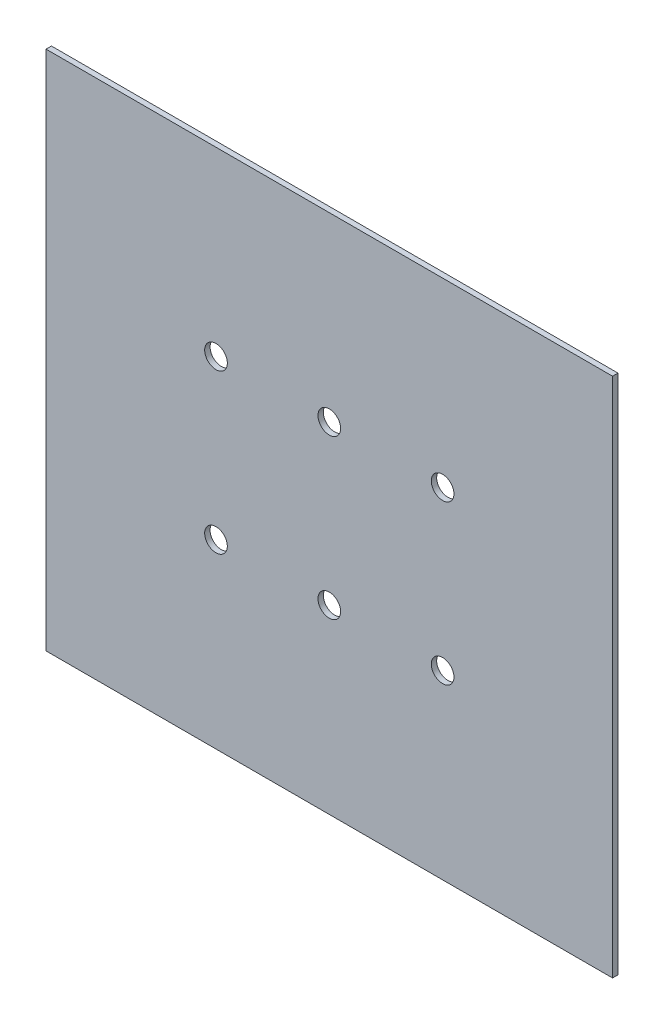
from build123d import *

# Parameters (mm, degrees)
ESBO_O1_W                = 500
ESBO_O1_H                = 460
ESBO_O1_R                = 10
RESSALTO_EXTRUS_O1_DEPTH = 4.7625


with BuildPart() as part:
    # Esboço1 → Ressalto-extrusão1 (new body)
    with BuildSketch(Plane.XY):
        with Locations((-100, 70)):
            Rectangle(ESBO_O1_W, ESBO_O1_H)
        with Locations(Location((0, 0, 0), (0, 0, 180))):
            Circle(ESBO_O1_R, mode=Mode.SUBTRACT)
        with Locations(Location((-100, 0, 0), (0, 0, 180))):
            Circle(ESBO_O1_R, mode=Mode.SUBTRACT)
        with Locations(Location((-200, 0, 0), (0, 0, 180))):
            Circle(ESBO_O1_R, mode=Mode.SUBTRACT)
        with Locations(Location((-200, 140, 0), (0, 0, 180))):
            Circle(ESBO_O1_R, mode=Mode.SUBTRACT)
        with Locations(Location((-100, 140, 0), (0, 0, 180))):
            Circle(ESBO_O1_R, mode=Mode.SUBTRACT)
        with Locations(Location((0, 140, 0), (0, 0, 180))):
            Circle(ESBO_O1_R, mode=Mode.SUBTRACT)
    extrude(amount=RESSALTO_EXTRUS_O1_DEPTH)


solid = part.part
